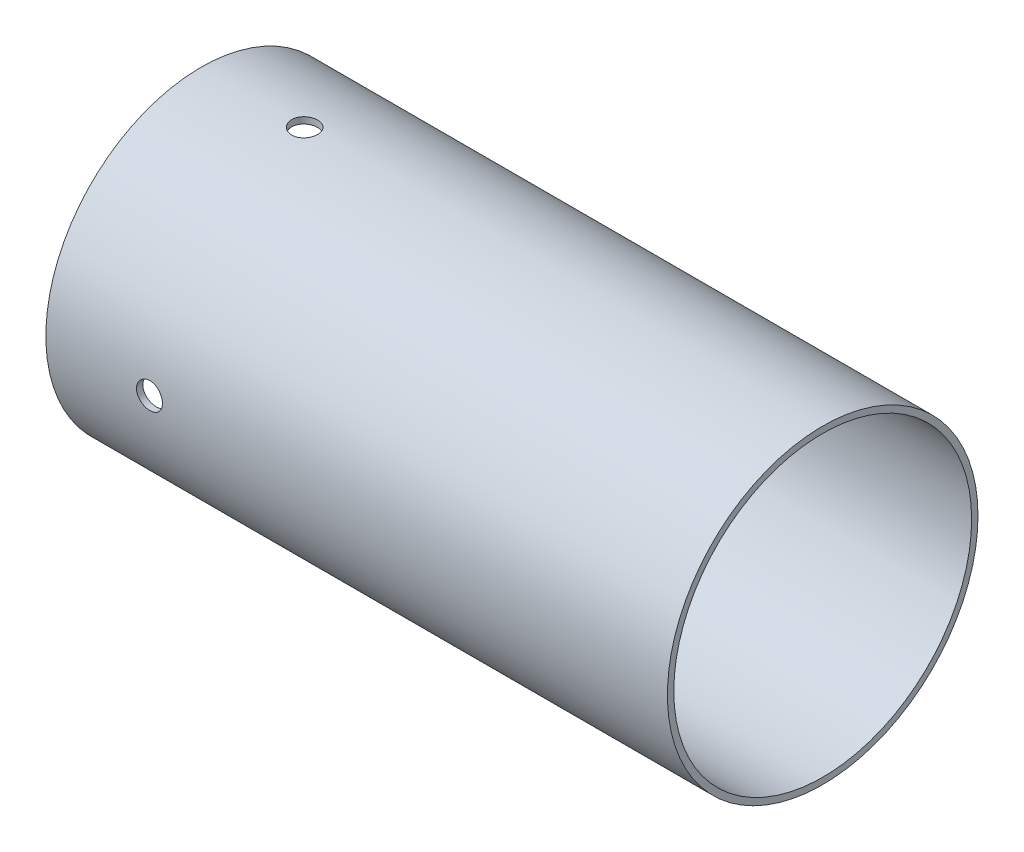
from build123d import *

# Parameters (mm, degrees)
SKETCH1_R           = 38.0746
SKETCH1_R_2         = 36.5125
BOSS_EXTRUDE1_DEPTH = 152.4
SKETCH3_R           = 3.175
CUT_EXTRUDE1_DEPTH  = 162.632640052
CIRPATTERN1_COUNT   = 4


with BuildPart() as part:
    # Sketch1 → Boss-Extrude1 (new body)
    with BuildSketch(Plane.YZ):
        with Locations(Location((0, 0, 0), (0, 0, 90))):
            Circle(SKETCH1_R)
        with Locations(Location((0, 0, 0), (0, 0, 90))):
            Circle(SKETCH1_R_2, mode=Mode.SUBTRACT)
    extrude(amount=BOSS_EXTRUDE1_DEPTH)

    # Sketch3 → Cut-Extrude1 (cut, through all)
    with BuildSketch(Plane(origin=(0, 0, 0), x_dir=(-1, 0, 0), z_dir=(0, 1, 0))):
        with Locations(Location((-25.4, 0, 0), (0, 0, 270))):
            Circle(SKETCH3_R)
    cut_extrude1 = extrude(amount=CUT_EXTRUDE1_DEPTH, mode=Mode.SUBTRACT)

    # CirPattern1: Cut-Extrude1 ×4 about axis
    cirpattern1_axis = Axis((152.4, 0, 0), (-1, 0, 0))
    for i in range(1, CIRPATTERN1_COUNT):
        add(cut_extrude1.rotate(cirpattern1_axis, i * 360 / CIRPATTERN1_COUNT), mode=Mode.SUBTRACT)


solid = part.part
